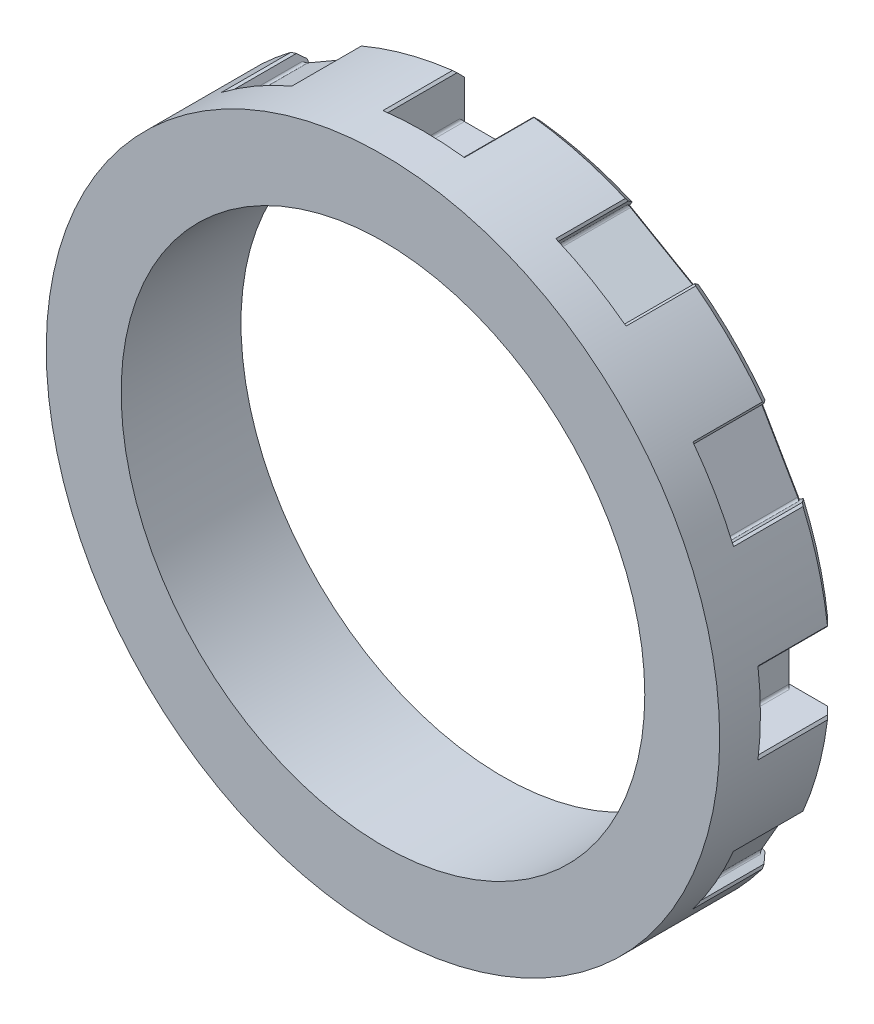
from build123d import *
from OCP.BRepFilletAPI import BRepFilletAPI_MakeChamfer

# Parameters (mm, degrees)
SKETCH_1_R               = 14.05
EXTRUDE_1_DEPTH          = 5
SKETCH_2_R               = 10.925
CUT_EXTRUDE_1_DEPTH      = 21.489143467
SKETCH_3_W               = 3.2
SKETCH_3_H               = 4
CUT_EXTRUDE_2_DEPTH      = 3.3
PATTERN_CIRCULAR_1_COUNT = 4
CUT_EXTRUDE_3_DEPTH      = 3.3
CHAMFER_1_SIZE           = 0.1
CHAMFER_1_SIZE2          = 0.090303758
FILLET_1_R               = 0.1
CHAMFER_2_SIZE           = 0.4


with BuildPart() as part:
    # ｽｹｯﾁ1 → ﾎﾞｽ - 押し出し1 (new body)
    with BuildSketch(Plane.XY):
        Circle(SKETCH_1_R)
    extrude(amount=EXTRUDE_1_DEPTH)

    # ｽｹｯﾁ2 → ｶｯﾄ - 押し出し1 (cut, through all)
    with BuildSketch(Plane.XY.offset(5)):
        Circle(SKETCH_2_R)
    extrude(amount=-CUT_EXTRUDE_1_DEPTH, mode=Mode.SUBTRACT)

    # ｽｹｯﾁ3 → ｶｯﾄ - 押し出し2 (cut)
    with BuildSketch(Plane.XY):
        with Locations((0, 14.05)):
            Rectangle(SKETCH_3_W, SKETCH_3_H)
    cut_extrude_2 = extrude(amount=CUT_EXTRUDE_2_DEPTH, mode=Mode.SUBTRACT)

    # 円形ﾊﾟﾀｰﾝ1: ｶｯﾄ - 押し出し2 ×4 about axis
    pattern_circular_1_axis = Axis((0, 0, 0), (0, 0, 1))
    for i in range(1, PATTERN_CIRCULAR_1_COUNT):
        add(cut_extrude_2.rotate(pattern_circular_1_axis, i * 360 / PATTERN_CIRCULAR_1_COUNT), mode=Mode.SUBTRACT)

    # ｽｹｯﾁ5 → ｶｯﾄ - 押し出し3 (cut)
    with BuildSketch(Plane.XY):
        with BuildLine():
            Line((8.114940396, 10.855489066), (8.364940396, 11.288501768))
            ThreePointArc((8.364940396, 11.288501768), (7.025, 12.167656923), (5.593659104, 12.888501768))
            Line((5.593659104, 12.888501768), (5.343659104, 12.455489066))
            Line((5.343659104, 12.455489066), (8.114940396, 10.855489066))
        make_face()
        with BuildLine():
            Line((11.288501768, 8.364940396), (10.855489066, 8.114940396))
            Line((10.855489066, 8.114940396), (12.455489066, 5.343659104))
            Line((12.455489066, 5.343659104), (12.888501768, 5.593659104))
            ThreePointArc((12.888501768, 5.593659104), (12.167656923, 7.025), (11.288501768, 8.364940396))
        make_face()
        with BuildLine():
            ThreePointArc((-8.364940396, 11.288501768), (-7.025, 12.167656923), (-5.593659104, 12.888501768))
            Line((-5.593659104, 12.888501768), (-5.343659104, 12.455489066))
            Line((-5.343659104, 12.455489066), (-8.114940396, 10.855489066))
            Line((-8.114940396, 10.855489066), (-8.364940396, 11.288501768))
        make_face()
        with BuildLine():
            Line((-11.288501768, 8.364940396), (-10.855489066, 8.114940396))
            Line((-10.855489066, 8.114940396), (-12.455489066, 5.343659104))
            Line((-12.455489066, 5.343659104), (-12.888501768, 5.593659104))
            ThreePointArc((-12.888501768, 5.593659104), (-12.167656923, 7.025), (-11.288501768, 8.364940396))
        make_face()
        with BuildLine():
            Line((-8.114940396, -10.855489066), (-8.364940396, -11.288501768))
            ThreePointArc((-8.364940396, -11.288501768), (-7.025, -12.167656923), (-5.593659104, -12.888501768))
            Line((-5.593659104, -12.888501768), (-5.343659104, -12.455489066))
            Line((-5.343659104, -12.455489066), (-8.114940396, -10.855489066))
        make_face()
        with BuildLine():
            ThreePointArc((8.364940396, -11.288501768), (7.025, -12.167656923), (5.593659104, -12.888501768))
            Line((5.593659104, -12.888501768), (5.343659104, -12.455489066))
            Line((5.343659104, -12.455489066), (8.114940396, -10.855489066))
            Line((8.114940396, -10.855489066), (8.364940396, -11.288501768))
        make_face()
        with BuildLine():
            Line((11.288501768, -8.364940396), (10.855489066, -8.114940396))
            Line((10.855489066, -8.114940396), (12.455489066, -5.343659104))
            Line((12.455489066, -5.343659104), (12.888501768, -5.593659104))
            ThreePointArc((12.888501768, -5.593659104), (12.167656923, -7.025), (11.288501768, -8.364940396))
        make_face()
        with BuildLine():
            ThreePointArc((-11.288501768, -8.364940396), (-12.167656923, -7.025), (-12.888501768, -5.593659104))
            Line((-12.888501768, -5.593659104), (-12.455489066, -5.343659104))
            Line((-12.455489066, -5.343659104), (-10.855489066, -8.114940396))
            Line((-10.855489066, -8.114940396), (-11.288501768, -8.364940396))
        make_face()
    extrude(amount=CUT_EXTRUDE_3_DEPTH, mode=Mode.SUBTRACT)

    # 面取り1: one chamfer whose edges measure the first distance from different faces: ONE call of the kernel's chamfer builder (chamfer() names one face for all edges)
    chamfer_1_edges_1 = [part.edges().sort_by_distance(p)[0] for p in [
        (-5.593659104, 12.888501768, 1.65),
        (-11.288501768, 8.364940396, 1.65),
        (-8.364940396, -11.288501768, 1.65),
        (5.593659104, -12.888501768, 1.65),
        (-1.6, 13.9585995, 1.65),
        (1.6, 13.9585995, 1.65),
        (11.288501768, -8.364940396, 1.65),
        (-12.888501768, -5.593659104, 1.65),
        (13.9585995, 1.6, 1.65),
        (13.9585995, -1.6, 1.65),
        (1.6, -13.9585995, 1.65),
        (-1.6, -13.9585995, 1.65),
        (-13.9585995, -1.6, 1.65),
        (-13.9585995, 1.6, 1.65),
        (8.364940396, 11.288501768, 1.65),
        (12.888501768, 5.593659104, 1.65),
    ]]
    chamfer_1_side_1 = [part.faces().sort_by_distance(p)[0] for p in [
        (-14.05, 0, 2.5),
    ]]
    chamfer_1_edges_2 = [part.edges().sort_by_distance(p)[0] for p in [
        (-8.364940396, 11.288501768, 1.65),
    ]]
    chamfer_1_side_2 = [part.faces().sort_by_distance(p)[0] for p in [
        (-8.239940396, 11.071995417, 1.65),
    ]]
    chamfer_1_edges_3 = [part.edges().sort_by_distance(p)[0] for p in [
        (-6.72929975, 11.655489066, 0),
        (-11.655489066, 6.72929975, 0),
        (-6.72929975, -11.655489066, 0),
        (6.72929975, -11.655489066, 0),
        (0, 12.05, 0),
        (11.655489066, -6.72929975, 0),
        (-11.655489066, -6.72929975, 0),
        (12.05, 0, 0),
        (0, -12.05, 0),
        (-12.05, 0, 0),
        (6.72929975, 11.655489066, 0),
        (11.655489066, 6.72929975, 0),
    ]]
    chamfer_1_edges_4 = [part.edges().sort_by_distance(p)[0] for p in [
        (-12.888501768, 5.593659104, 1.65),
    ]]
    chamfer_1_side_4 = [part.faces().sort_by_distance(p)[0] for p in [
        (-12.671995417, 5.468659104, 1.65),
    ]]
    chamfer_1_edges_5 = [part.edges().sort_by_distance(p)[0] for p in [
        (-5.593659104, -12.888501768, 1.65),
    ]]
    chamfer_1_side_5 = [part.faces().sort_by_distance(p)[0] for p in [
        (-5.468659104, -12.671995417, 1.65),
    ]]
    chamfer_1_edges_6 = [part.edges().sort_by_distance(p)[0] for p in [
        (8.364940396, -11.288501768, 1.65),
    ]]
    chamfer_1_side_6 = [part.faces().sort_by_distance(p)[0] for p in [
        (8.239940396, -11.071995417, 1.65),
    ]]
    chamfer_1_edges_7 = [part.edges().sort_by_distance(p)[0] for p in [
        (12.888501768, -5.593659104, 1.65),
    ]]
    chamfer_1_side_7 = [part.faces().sort_by_distance(p)[0] for p in [
        (12.671995417, -5.468659104, 1.65),
    ]]
    chamfer_1_edges_8 = [part.edges().sort_by_distance(p)[0] for p in [
        (-11.288501768, -8.364940396, 1.65),
    ]]
    chamfer_1_side_8 = [part.faces().sort_by_distance(p)[0] for p in [
        (-11.071995417, -8.239940396, 1.65),
    ]]
    chamfer_1_edges_9 = [part.edges().sort_by_distance(p)[0] for p in [
        (5.593659104, 12.888501768, 1.65),
    ]]
    chamfer_1_side_9 = [part.faces().sort_by_distance(p)[0] for p in [
        (5.468659104, 12.671995417, 1.65),
    ]]
    chamfer_1_edges_10 = [part.edges().sort_by_distance(p)[0] for p in [
        (11.288501768, 8.364940396, 1.65),
    ]]
    chamfer_1_side_10 = [part.faces().sort_by_distance(p)[0] for p in [
        (11.071995417, 8.239940396, 1.65),
    ]]
    chamfer_1 = BRepFilletAPI_MakeChamfer(part.part.solid().wrapped)
    for e in chamfer_1_edges_1:
        chamfer_1.Add(CHAMFER_1_SIZE, CHAMFER_1_SIZE2, e.wrapped, chamfer_1_side_1[0].wrapped)  # the first distance lies on this face
    for e in chamfer_1_edges_2:
        chamfer_1.Add(CHAMFER_1_SIZE, CHAMFER_1_SIZE2, e.wrapped, chamfer_1_side_2[0].wrapped)  # the first distance lies on this face
    for e in chamfer_1_edges_3:
        chamfer_1.Add(CHAMFER_1_SIZE, e.wrapped)
    for e in chamfer_1_edges_4:
        chamfer_1.Add(CHAMFER_1_SIZE, CHAMFER_1_SIZE2, e.wrapped, chamfer_1_side_4[0].wrapped)  # the first distance lies on this face
    for e in chamfer_1_edges_5:
        chamfer_1.Add(CHAMFER_1_SIZE, CHAMFER_1_SIZE2, e.wrapped, chamfer_1_side_5[0].wrapped)  # the first distance lies on this face
    for e in chamfer_1_edges_6:
        chamfer_1.Add(CHAMFER_1_SIZE, CHAMFER_1_SIZE2, e.wrapped, chamfer_1_side_6[0].wrapped)  # the first distance lies on this face
    for e in chamfer_1_edges_7:
        chamfer_1.Add(CHAMFER_1_SIZE, CHAMFER_1_SIZE2, e.wrapped, chamfer_1_side_7[0].wrapped)  # the first distance lies on this face
    for e in chamfer_1_edges_8:
        chamfer_1.Add(CHAMFER_1_SIZE, CHAMFER_1_SIZE2, e.wrapped, chamfer_1_side_8[0].wrapped)  # the first distance lies on this face
    for e in chamfer_1_edges_9:
        chamfer_1.Add(CHAMFER_1_SIZE, CHAMFER_1_SIZE2, e.wrapped, chamfer_1_side_9[0].wrapped)  # the first distance lies on this face
    for e in chamfer_1_edges_10:
        chamfer_1.Add(CHAMFER_1_SIZE, CHAMFER_1_SIZE2, e.wrapped, chamfer_1_side_10[0].wrapped)  # the first distance lies on this face
    add(Compound.cast(chamfer_1.Shape()), mode=Mode.REPLACE)

    # ﾌｨﾚｯﾄ1
    fillet_1_edges = [part.edges().sort_by_distance(p)[0] for p in [
        (-8.114940396, 10.855489066, 1.7),
        (-5.343659104, 12.455489066, 1.7),
        (-10.855489066, 8.114940396, 1.7),
        (-12.455489066, 5.343659104, 1.7),
        (-8.114940396, -10.855489066, 1.7),
        (-5.343659104, -12.455489066, 1.7),
        (1.6, 12.05, 1.7),
        (8.114940396, -10.855489066, 1.7),
        (5.343659104, -12.455489066, 1.7),
        (-1.6, 12.05, 1.7),
        (10.855489066, -8.114940396, 1.7),
        (12.455489066, -5.343659104, 1.7),
        (-10.855489066, -8.114940396, 1.7),
        (-12.455489066, -5.343659104, 1.7),
        (12.05, -1.6, 1.7),
        (12.05, 1.6, 1.7),
        (-1.6, -12.05, 1.7),
        (1.6, -12.05, 1.7),
        (-12.05, 1.6, 1.7),
        (-12.05, -1.6, 1.7),
        (8.114940396, 10.855489066, 1.7),
        (5.343659104, 12.455489066, 1.7),
        (10.855489066, 8.114940396, 1.7),
        (12.455489066, 5.343659104, 1.7),
    ]]
    fillet(fillet_1_edges, radius=FILLET_1_R)

    # 面取り2
    chamfer_2_edges = [part.edges().sort_by_distance(p)[0] for p in [
        (13.571257859, 3.636407584, 0),
        (13.570002258, -3.641090319, 0),
        (9.931421525, -9.938277843, 0),
        (3.636407584, -13.571257859, 0),
        (-3.641090319, -13.570002258, 0),
        (-9.938277843, -9.931421525, 0),
        (-13.571257859, -3.636407584, 0),
        (-13.570002258, 3.641090319, 0),
        (-9.931421525, 9.938277843, 0),
        (-3.636407584, 13.571257859, 0),
        (3.641090319, 13.570002258, 0),
        (9.938277843, 9.931421525, 0),
    ]]
    chamfer(chamfer_2_edges, length=CHAMFER_2_SIZE)


solid = part.part
